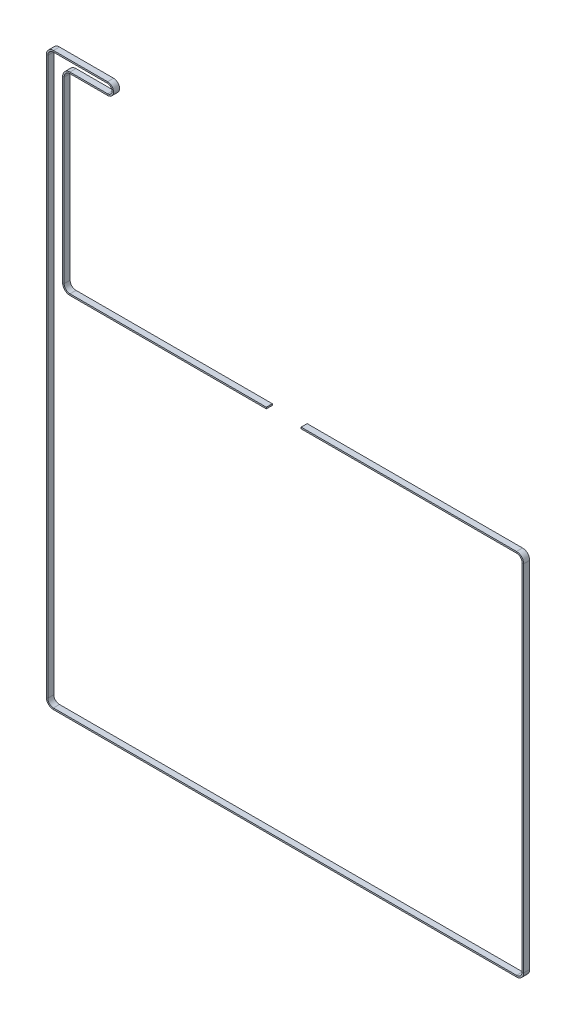
from build123d import *

# Parameters (mm, degrees)
SKETCH2_W = 6
SKETCH2_H = 1.5


with BuildPart() as part:
    # Sweep1: sweep along a path in Sketch1
    with BuildLine(Plane(origin=(0, -21, 4.45), x_dir=(1, 0, 0), z_dir=(0, 0, 1))) as sweep1_path:
        Line((240.590579323, -128.169321697), (455.5, -128.169321697))
        ThreePointArc((455.5, -128.169321697), (460.007802007, -130.036514405), (461.874994781, -134.544316384))
        Line((461.874994781, -134.544316384), (461.875, -488))
        ThreePointArc((461.875, -488), (460.00780573, -492.50780573), (455.5, -494.375))
        Line((455.5, -494.375), (-6.5, -494.375))
        ThreePointArc((-6.5, -494.375), (-11.00780573, -492.50780573), (-12.875, -488))
        Line((-12.875, -488), (-12.875, 67.325))
        ThreePointArc((-12.875, 67.325), (-11.00780573, 71.83280573), (-6.5, 73.7))
        Line((-6.5, 73.7), (47.5, 73.7))
        ThreePointArc((47.5, 73.7), (52.7, 68.5), (47.5, 63.3))
        Line((47.5, 63.3), (10, 63.3))
        ThreePointArc((10, 63.3), (5.333095244, 61.366904756), (3.4, 56.7))
        Line((3.4, 56.7), (3.4, -121.719327623))
        ThreePointArc((3.4, -121.719327623), (5.333095244, -126.386232379), (10, -128.319327623))
        Line((10, -128.319327623), (205.890579323, -128.319327623))
    # Sketch2 → Sweep1 (sweep)
    with BuildSketch(Plane(origin=(240.590579323, -149.169321697, 4.45), x_dir=(0, 0, 1), z_dir=(-1, 0, 0))):
        Rectangle(SKETCH2_W, SKETCH2_H)
    sweep(path=sweep1_path.line)


solid = part.part
